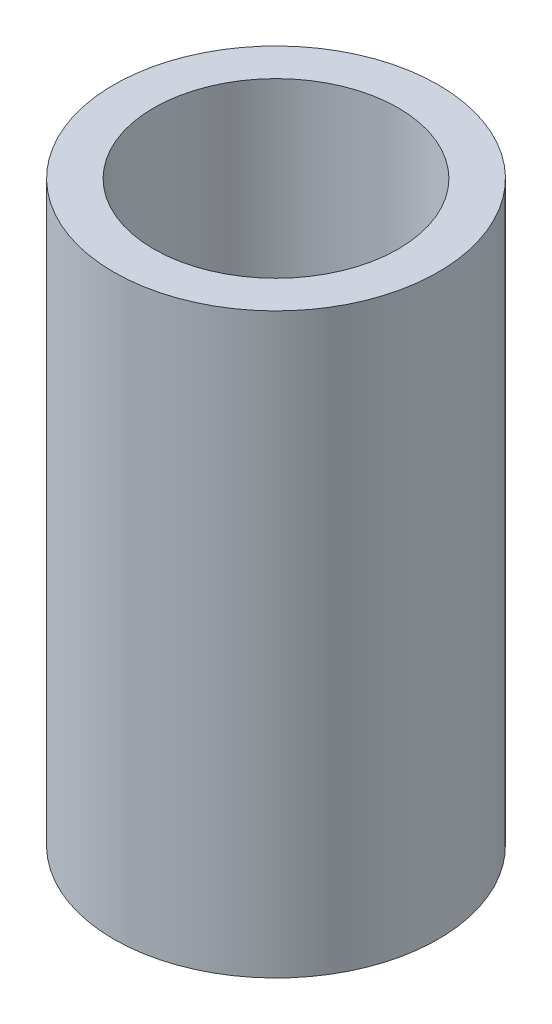
from build123d import *

# Parameters (mm, degrees)
SZKIC1_R                    = 16.85
SZKIC1_R_2                  = 12.7
DODANIE_WYCI_GNI_CIE1_DEPTH = 60


with BuildPart() as part:
    # Szkic1 → Dodanie-wyciągnięcie1 (new body)
    with BuildSketch(Plane(origin=(0, 0, 0), x_dir=(1, 0, 0), z_dir=(0, 1, 0))):
        with Locations(Location((0, 0, 0), (0, 0, 270))):
            Circle(SZKIC1_R)
        with Locations(Location((0, 0, 0), (0, 0, 270))):
            Circle(SZKIC1_R_2, mode=Mode.SUBTRACT)
    extrude(amount=DODANIE_WYCI_GNI_CIE1_DEPTH)


solid = part.part
